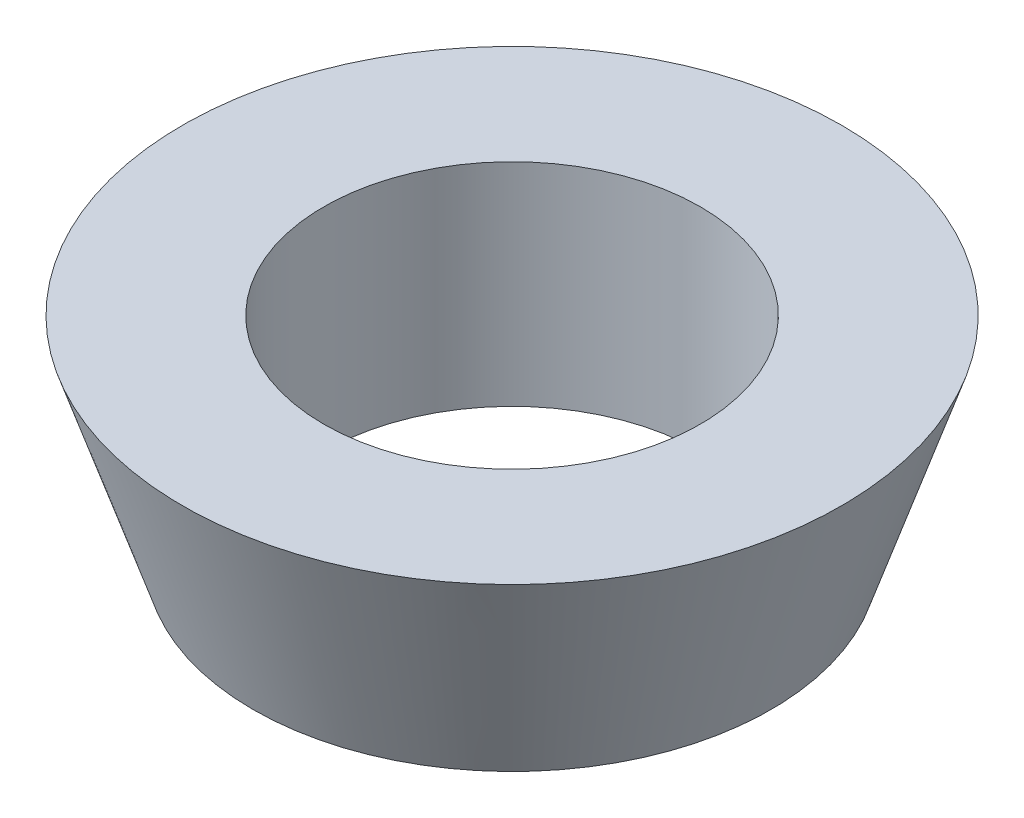
from build123d import *


with BuildPart() as part:
    # Esquisse1 → Révolution1 (revolve)
    with BuildSketch(Plane.XY, mode=Mode.PRIVATE) as r_volution1_sk:
        Polygon((4, 4.5), (7, 4.5), (5.5, 0), (4, 0), align=None)
    revolve(r_volution1_sk.sketch.rotate(Axis((0, 0, 0), (0, 1, 0)), 90), axis=Axis((0, 0, 0), (0, 1, 0)))


solid = part.part
